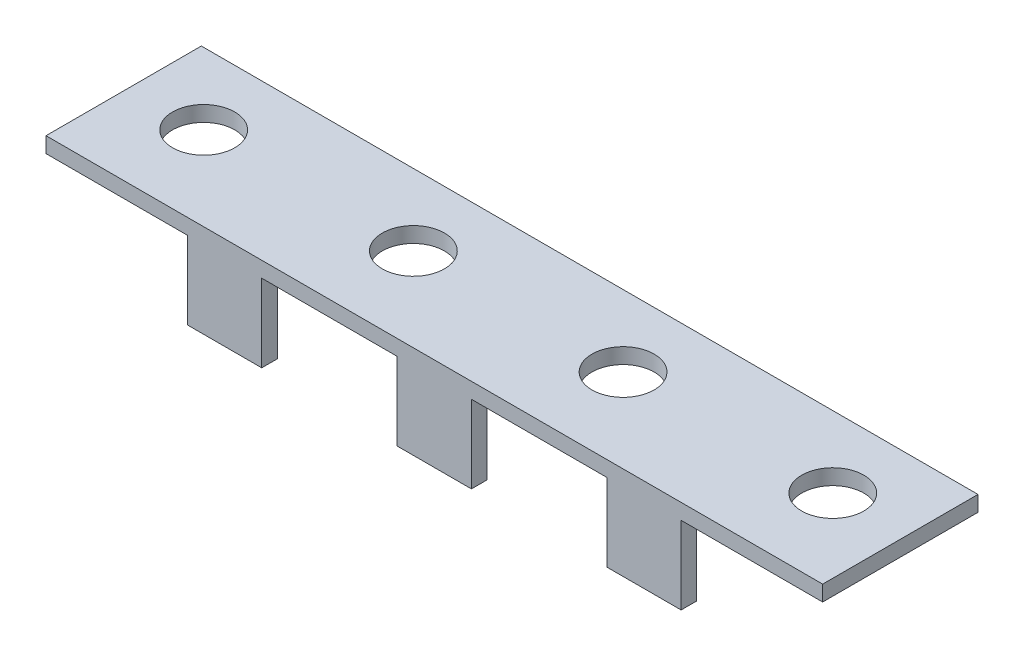
from build123d import *

# Parameters (mm, degrees)
SKETCH1_W           = 127
SKETCH1_H           = 25.4
SKETCH1_R           = 5.08
BOSS_EXTRUDE1_DEPTH = 2.54
SKETCH2_W           = 127
SKETCH2_H           = 2.54
BOSS_EXTRUDE2_DEPTH = 12.7
SKETCH4_W           = 23.145
SKETCH4_H           = 12.7
SKETCH4_W_2         = 22.16
CUT_EXTRUDE1_DEPTH  = 2.54


with BuildPart() as part:
    # Sketch1 → Boss-Extrude1 (new body)
    with BuildSketch(Plane(origin=(0, 0, 0), x_dir=(1, 0, 0), z_dir=(0, 1, 0))):
        with Locations((63.5, 12.7)):
            Rectangle(SKETCH1_W, SKETCH1_H)
        with Locations(Location((12.065, 13.716, 0), (0, 0, 270))):
            Circle(SKETCH1_R, mode=Mode.SUBTRACT)
        with Locations(Location((46.355, 13.716, 0), (0, 0, 270))):
            Circle(SKETCH1_R, mode=Mode.SUBTRACT)
        with Locations(Location((80.645, 13.716, 0), (0, 0, 270))):
            Circle(SKETCH1_R, mode=Mode.SUBTRACT)
        with Locations(Location((114.935, 13.716, 0), (0, 0, 270))):
            Circle(SKETCH1_R, mode=Mode.SUBTRACT)
    extrude(amount=BOSS_EXTRUDE1_DEPTH)

    # Sketch2 → Boss-Extrude2 (add)
    with BuildSketch(Plane.XZ):
        with Locations((63.5, -1.27)):
            Rectangle(SKETCH2_W, SKETCH2_H)
    extrude(amount=BOSS_EXTRUDE2_DEPTH)

    # Sketch4 → Cut-Extrude1 (cut)
    with BuildSketch(Plane(origin=(0, 0, -2.54), x_dir=(-1, 0, 0), z_dir=(0, 0, -1))):
        with Locations((-115.4275, -6.35)):
            Rectangle(SKETCH4_W, SKETCH4_H)
        with Locations((-80.645, -6.35)):
            Rectangle(SKETCH4_W_2, SKETCH4_H)
        with Locations((-46.355, -6.35)):
            Rectangle(SKETCH4_W_2, SKETCH4_H)
        with Locations((-11.5725, -6.35)):
            Rectangle(SKETCH4_W, SKETCH4_H)
    extrude(amount=-CUT_EXTRUDE1_DEPTH, mode=Mode.SUBTRACT)


solid = part.part
